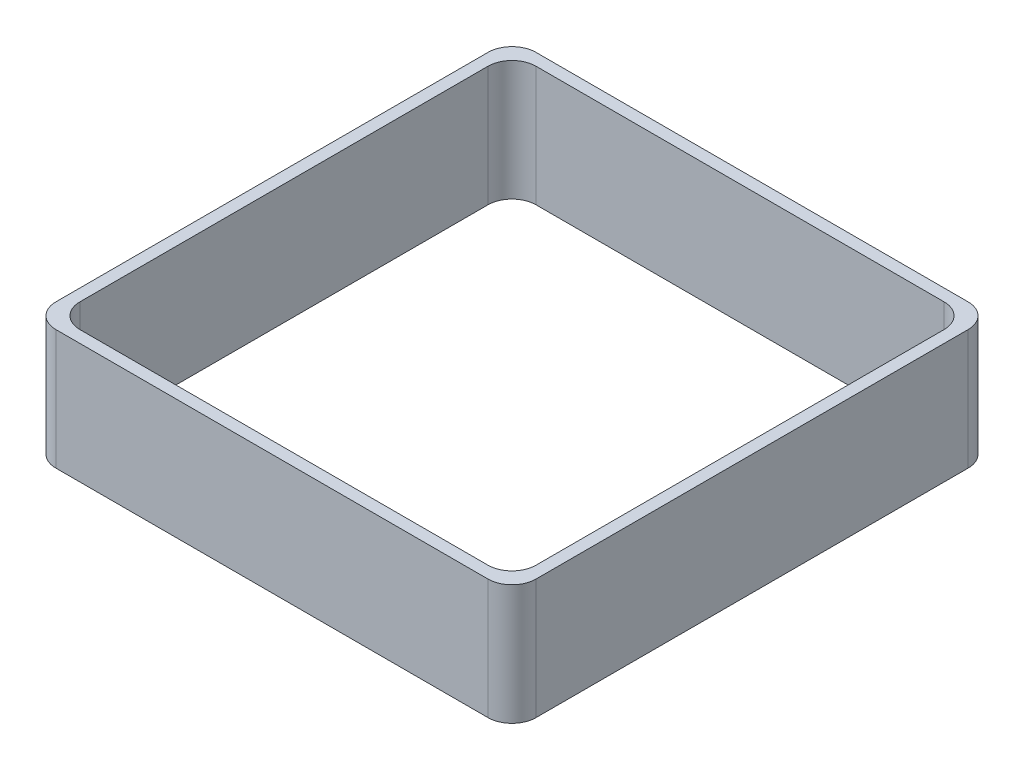
from build123d import *

# Parameters (mm, degrees)
SKETCH_1_W      = 200
SKETCH_1_H      = 200
SKETCH_1_W_2    = 190
SKETCH_1_H_2    = 190
EXTRUDE_1_DEPTH = 50
FILLET_1_R      = 10


with BuildPart() as part:
    # 草图1 → 凸台-拉伸1 (new body)
    with BuildSketch(Plane(origin=(0, 0, 0), x_dir=(1, 0, 0), z_dir=(0, 1, 0))):
        Rectangle(SKETCH_1_W, SKETCH_1_H)
        Rectangle(SKETCH_1_W_2, SKETCH_1_H_2, mode=Mode.SUBTRACT)
    extrude(amount=EXTRUDE_1_DEPTH)

    # 圆角1
    fillet_1_edges = [part.edges().sort_by_distance(p)[0] for p in [
        (95, 25, 95),
        (95, 25, -95),
        (-95, 25, -95),
        (-95, 25, 95),
        (-100, 25, -100),
        (100, 25, -100),
        (100, 25, 100),
        (-100, 25, 100),
    ]]
    fillet(fillet_1_edges, radius=FILLET_1_R)


solid = part.part
